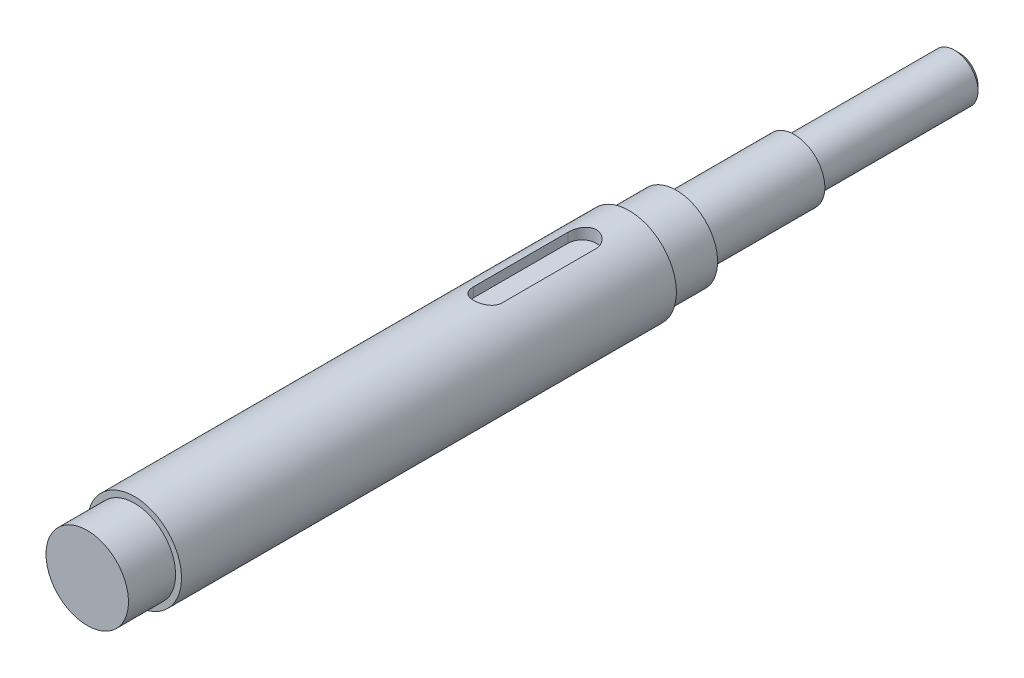
from build123d import *

# Parameters (mm, degrees)
CUT_EXTRUDE1_DEPTH = 5
CHAMFER1_SIZE      = 2


with BuildPart() as part:
    # Sketch1 → Revolve1 (revolve)
    with BuildSketch(Plane(origin=(0, 0, 0), x_dir=(1, 0, 0), z_dir=(0, 1, 0)), mode=Mode.PRIVATE) as revolve1_sk:
        Polygon((0, 0), (0, -370), (17.5, -370), (17.5, -350), (20, -350), (20, -140), (17.5, -140), (17.5, -120), (13, -120), (13, -70), (10, -70), (10, 0), align=None)
    revolve(revolve1_sk.sketch.rotate(Axis((0, 0, 0), (0, 0, 1)), 180), axis=Axis((0, 0, 0), (0, 0, 1)))

    # Sketch3 → Cut-Extrude1 (cut)
    with BuildSketch(Plane(origin=(-7.563219115, 20, 140), x_dir=(0, 0, -1), z_dir=(0, -1, 0))):
        with BuildLine():
            Line((-20, 13.563219115), (-60, 13.563219115))
            ThreePointArc((-60, 13.563219115), (-66, 7.563219115), (-60, 1.563219115))
            Line((-60, 1.563219115), (-20, 1.563219115))
            ThreePointArc((-20, 1.563219115), (-14, 7.563219115), (-20, 13.563219115))
        make_face()
    extrude(amount=CUT_EXTRUDE1_DEPTH, mode=Mode.SUBTRACT)

    # Chamfer1
    chamfer1_edges = [part.edges().sort_by_distance(p)[0] for p in [
        (10, 0, 0),
    ]]
    chamfer(chamfer1_edges, length=CHAMFER1_SIZE)


solid = part.part
